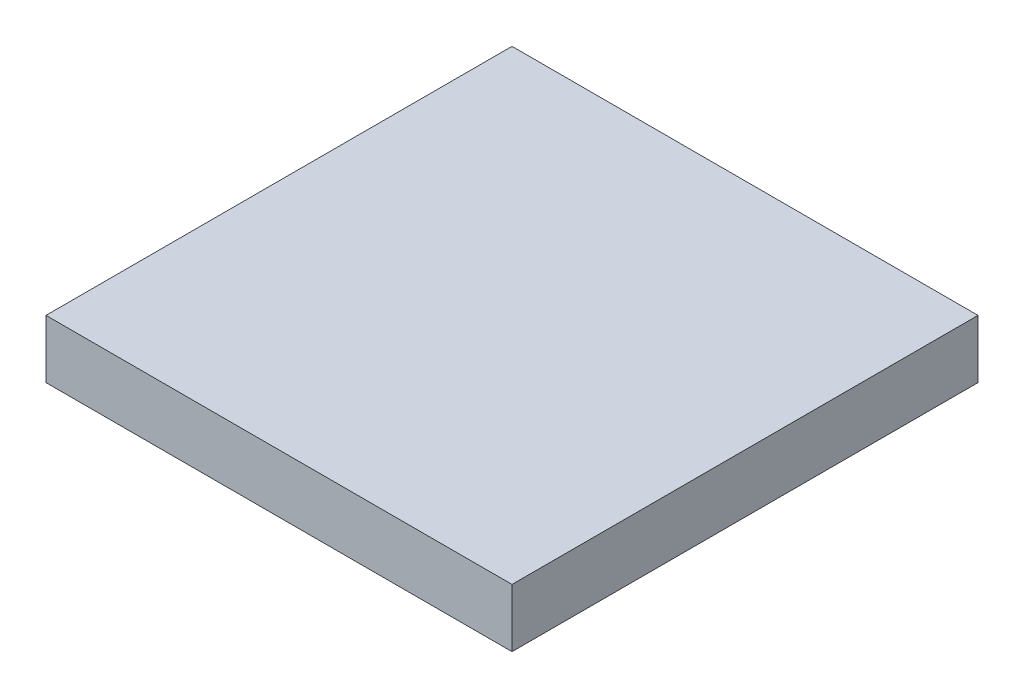
from build123d import *

# Parameters (mm, degrees)
BOSS_EXTRUDE1_DEPTH      = 12.7
BOSS_EXTRUDE1_DEPTH_BACK = 12.7
SKETCH3_W                = 25.4
SKETCH3_H                = 3.175


with BuildPart() as part:
    # Sketch3 → Boss-Extrude1 (new, two sides: drawn at the far end of the back side and taken through both)
    with BuildSketch(Plane.XY.offset(-BOSS_EXTRUDE1_DEPTH_BACK)):
        Rectangle(SKETCH3_W, SKETCH3_H)
    extrude(amount=BOSS_EXTRUDE1_DEPTH + BOSS_EXTRUDE1_DEPTH_BACK)


solid = part.part
